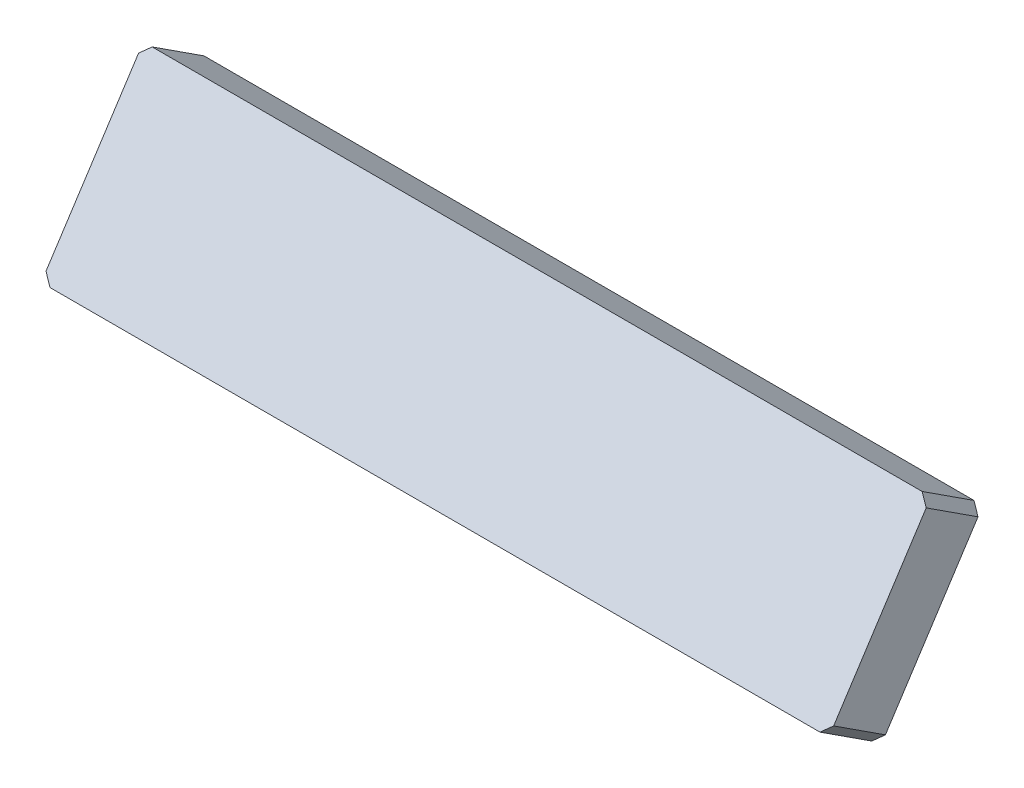
from build123d import *

# Parameters (mm, degrees)
SKETCH2_R             = 7.6
BOSS_EXTRUDE1_DEPTH   = 19.05
BOSS_EXTRUDE1_2_DEPTH = 19.05
SKETCH3_W             = 141.7
SKETCH3_H             = 33.75
BOSS_EXTRUDE2_DEPTH   = 12.7
BOSS_EXTRUDE3_REACH   = 78.533
CHAMFER2_SIZE         = 1.5875


with BuildPart() as part:
    # Sketch2 → Boss-Extrude1 (new body)
    with BuildSketch(Plane(origin=(0, 0, 0), x_dir=(1, 0, 0), z_dir=(0, 1, 0))):
        with Locations((-50.8, 0)):
            Circle(SKETCH2_R)
    extrude(amount=BOSS_EXTRUDE1_DEPTH)



with BuildPart() as body_2:
    # Sketch2 → Boss-Extrude1 2 (new body)
    with BuildSketch(Plane(origin=(0, 0, 0), x_dir=(1, 0, 0), z_dir=(0, 1, 0))):
        with Locations((50.8, 0)):
            Circle(SKETCH2_R)
    extrude(amount=BOSS_EXTRUDE1_2_DEPTH)


with BuildPart() as part_1:
    add(part.part)

    add(body_2.part)  # Boss-Extrude2 merges body 2
    # Sketch3 → Boss-Extrude2 (add)
    with BuildSketch(Plane(origin=(0, 5.650833475, 8.701520484), x_dir=(-1, 0, 0), z_dir=(0, 0.5446390350150281, 0.8386705679454234))):
        with Locations((0, -15.976674319)):
            Rectangle(SKETCH3_W, SKETCH3_H)
    extrude(amount=BOSS_EXTRUDE2_DEPTH)

    # Sketch8 → Boss-Extrude3 (add, up to next)
    with BuildSketch(Plane(origin=(0, 19.05, 0), x_dir=(1, 0, 0), z_dir=(0, 1, 0)), mode=Mode.PRIVATE) as boss_extrude3_sk1:
        with BuildLine():
            ThreePointArc((58.4, 0), (50.8, 7.6), (43.2, 0))
            Line((43.2, 0), (58.4, 0))
        make_face()
    boss_extrude3_tool1 = extrude(boss_extrude3_sk1.sketch, amount=BOSS_EXTRUDE3_REACH, mode=Mode.PRIVATE) - part_1.part
    # Sketch8 → Boss-Extrude3 (add, up to next)
    with BuildSketch(Plane(origin=(0, 19.05, 0), x_dir=(1, 0, 0), z_dir=(0, 1, 0)), mode=Mode.PRIVATE) as boss_extrude3_sk2:
        with BuildLine():
            ThreePointArc((-43.2, 0), (-50.8, 7.6), (-58.4, 0))
            Line((-58.4, 0), (-43.2, 0))
        make_face()
    boss_extrude3_tool2 = extrude(boss_extrude3_sk2.sketch, amount=BOSS_EXTRUDE3_REACH, mode=Mode.PRIVATE) - part_1.part
    add(boss_extrude3_tool1.solids().sort_by_distance((50.8, 19.05, -3.22554))[0])
    add(boss_extrude3_tool2.solids().sort_by_distance((-50.8, 19.05, -3.22554))[0])

    # Chamfer2
    chamfer2_edges = [part_1.edges().sort_by_distance(p)[0] for p in [
        (-70.85, 19.05, 0),
        (0, 33.202565834, -9.190783716),
        (70.85, 19.05, 0),
        (0, 4.897434166, 9.190783716),
        (-70.85, 8.355892038, 14.516341822),
        (70.85, 8.355892038, 14.516341822),
        (70.85, 36.661023706, -3.865225609),
        (-70.85, 36.661023706, -3.865225609),
    ]]
    chamfer(chamfer2_edges, length=CHAMFER2_SIZE)


solid = part_1.part
